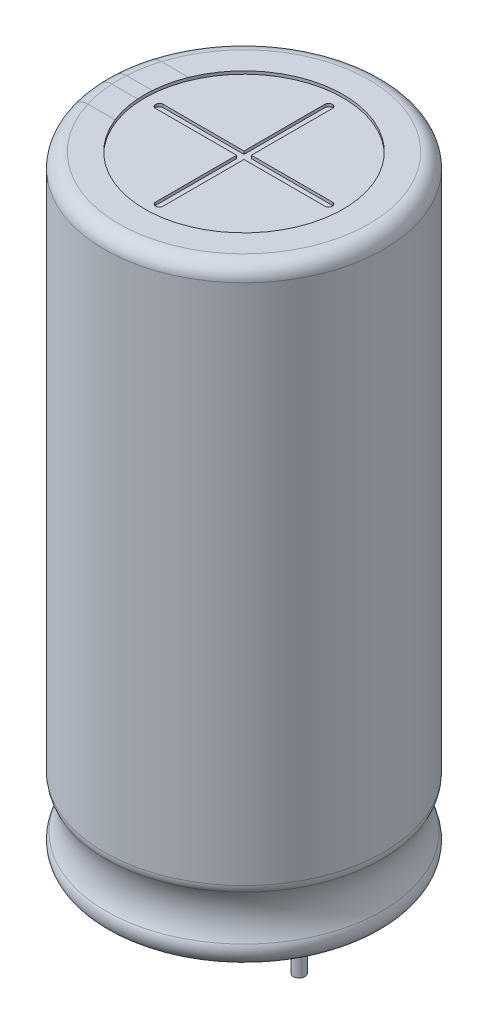
from build123d import *

# Parameters (mm, degrees)
SKETCH_3_R          = 6.75
CUT_EXTRUDE_1_DEPTH = 0.2
CUT_EXTRUDE_2_DEPTH = 0.2
SKETCH_5_R          = 7.3
CUT_EXTRUDE_3_DEPTH = 0.2
EXTRUDE_1_DEPTH     = 1.2
SKETCH_7_R          = 0.4
EXTRUDE_2_DEPTH     = 5.2


with BuildPart() as part:
    # Эскиз2 → Повернуть1 (revolve)
    with BuildSketch(Plane.XY):
        with BuildLine():
            Line((0, 0), (8.5, 0))
            ThreePointArc((8.5, 0), (9.207106781, 0.292893219), (9.5, 1))
            ThreePointArc((9.5, 1), (9.4701425, 1.242535625), (9.382352941, 1.470588235))
            ThreePointArc((9.382352941, 1.470588235), (9, 3), (9.382352941, 4.529411765))
            ThreePointArc((9.382352941, 4.529411765), (9.4701425, 4.757464375), (9.5, 5))
            Line((9.5, 5), (9.5, 40.5))
            ThreePointArc((9.5, 40.5), (9.207106781, 41.207106781), (8.5, 41.5))
            Line((8.5, 41.5), (0, 41.5))
            Line((0, 41.5), (0, 0))
        make_face()
    revolve(axis=Axis((0, 0, 0), (0, 1, 0)))

    # Эскиз3 → Вырез-Вытянуть1 (cut)
    with BuildSketch(Plane(origin=(0, 41.5, 0), x_dir=(1, 0, 0), z_dir=(0, 1, 0))):
        with Locations(Location((0, 0, 0), (0, 0, 180))):
            Circle(SKETCH_3_R)
    extrude(amount=-CUT_EXTRUDE_1_DEPTH, mode=Mode.SUBTRACT)

    # Эскиз4 → Вырез-Вытянуть2 (cut)
    with BuildSketch(Plane(origin=(0, 41.3, 0), x_dir=(1, 0, 0), z_dir=(0, 1, 0))):
        with BuildLine():
            Line((-0.25, -0.25), (-0.25, -5.76))
            ThreePointArc((-0.25, -5.76), (-0.179705627, -5.929705627), (-0.01, -6))
            Line((-0.01, -6), (0.01, -6))
            ThreePointArc((0.01, -6), (0.179705627, -5.929705627), (0.25, -5.76))
            Line((0.25, -5.76), (0.25, -0.25))
            Line((0.25, -0.25), (5.76, -0.25))
            ThreePointArc((5.76, -0.25), (5.929705627, -0.179705627), (6, -0.01))
            Line((6, -0.01), (6, 0.01))
            ThreePointArc((6, 0.01), (5.929705627, 0.179705627), (5.76, 0.25))
            Line((5.76, 0.25), (0.25, 0.25))
            Line((0.25, 0.25), (0.25, 5.76))
            ThreePointArc((0.25, 5.76), (0.179705627, 5.929705627), (0.01, 6))
            Line((0.01, 6), (-0.01, 6))
            ThreePointArc((-0.01, 6), (-0.179705627, 5.929705627), (-0.25, 5.76))
            Line((-0.25, 5.76), (-0.25, 0.25))
            Line((-0.25, 0.25), (-5.76, 0.25))
            ThreePointArc((-5.76, 0.25), (-5.929705627, 0.179705627), (-6, 0.01))
            Line((-6, 0.01), (-6, -0.01))
            ThreePointArc((-6, -0.01), (-5.929705627, -0.179705627), (-5.76, -0.25))
            Line((-5.76, -0.25), (-0.25, -0.25))
        make_face()
    extrude(amount=-CUT_EXTRUDE_2_DEPTH, mode=Mode.SUBTRACT)

    # Эскиз5 → Вырез-Вытянуть3 (cut)
    with BuildSketch(Plane.XZ):
        Circle(SKETCH_5_R)
    extrude(amount=-CUT_EXTRUDE_3_DEPTH, mode=Mode.SUBTRACT)

    # Эскиз6 → Бобышка-Вытянуть1 (add)
    with BuildSketch(Plane.XZ.offset(-0.2)):
        with BuildLine():
            Line((-5.337602458, 2), (5.337602458, 2))
            ThreePointArc((5.337602458, 2), (0, 5.7), (-5.337602458, 2))
        make_face()
        with BuildLine():
            Line((-5.337602458, -2), (5.337602458, -2))
            ThreePointArc((5.337602458, -2), (0, -5.7), (-5.337602458, -2))
        make_face()
    extrude(amount=EXTRUDE_1_DEPTH)

    # Эскиз7 → Бобышка-Вытянуть2 (add)
    with BuildSketch(Plane.XZ.offset(-0.2)):
        with Locations((-3.75, 0)):
            Circle(SKETCH_7_R)
        with Locations((3.75, 0)):
            Circle(SKETCH_7_R)
    extrude(amount=EXTRUDE_2_DEPTH)


solid = part.part
